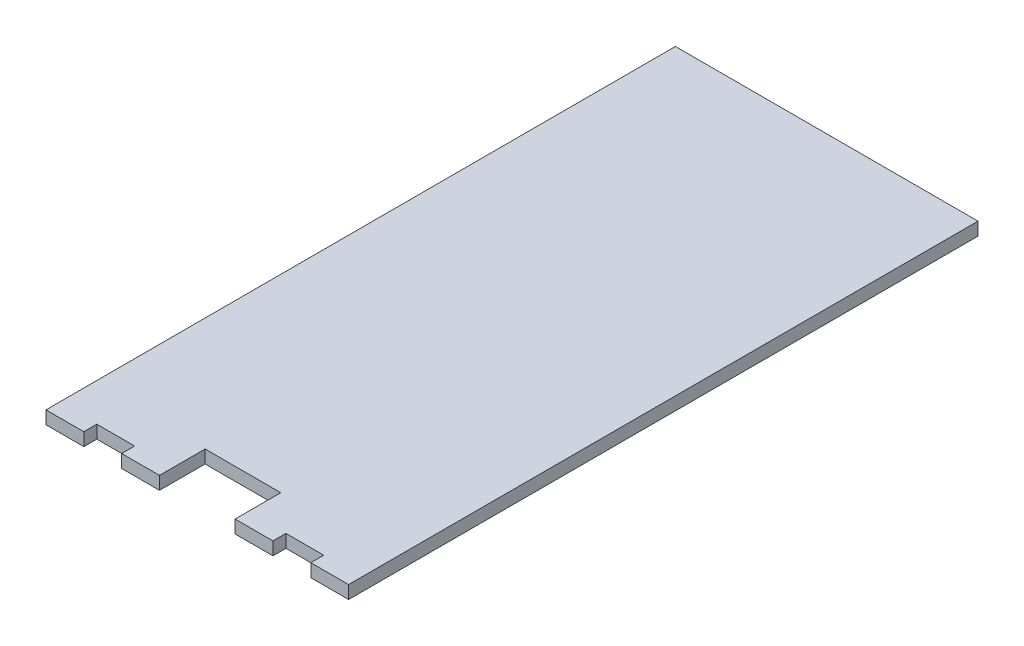
from build123d import *

# Parameters (mm, degrees)
SKETCH1_W           = 194.183
SKETCH1_H           = 403.89048
BOSS_EXTRUDE1_DEPTH = 8.3312
SKETCH2_W           = 24.272875
SKETCH2_H           = 8.3312
SKETCH2_H_2         = 29.2862
CUT_EXTRUDE1_DEPTH  = 375.210746987


with BuildPart() as part:
    # Sketch1 → Boss-Extrude1 (new body)
    with BuildSketch(Plane(origin=(0, 0, 0), x_dir=(1, 0, 0), z_dir=(0, 1, 0))):
        with Locations((2.123523474, -158.777164883)):
            Rectangle(SKETCH1_W, SKETCH1_H)
    extrude(amount=BOSS_EXTRUDE1_DEPTH)

    # Sketch2 → Cut-Extrude1 (cut, through all)
    with BuildSketch(Plane.XZ):
        with Locations((-58.558664026, 356.556804883)):
            Rectangle(SKETCH2_W, SKETCH2_H)
        with Locations((-10.012914026, 346.079304883)):
            Rectangle(SKETCH2_W, SKETCH2_H_2)
        with Locations((14.259960974, 346.079304883)):
            Rectangle(SKETCH2_W, SKETCH2_H_2)
        with Locations((62.805710974, 356.556804883)):
            Rectangle(SKETCH2_W, SKETCH2_H)
    extrude(amount=-CUT_EXTRUDE1_DEPTH, mode=Mode.SUBTRACT)


solid = part.part
